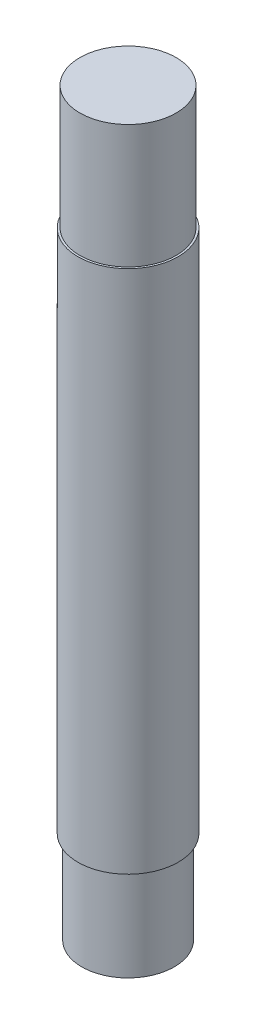
from build123d import *

# Parameters (mm, degrees)
SKETCH1_R           = 5.159375
BOSS_EXTRUDE1_DEPTH = 76.2
SKETCH2_R           = 5.582507509
SKETCH2_R_2         = 4.95
CUT_EXTRUDE1_DEPTH  = 12.7
CUT_EXTRUDE2_DEPTH  = 15.24
SKETCH5_R           = 6.855394903
SKETCH5_R_2         = 4.7625
CUT_EXTRUDE3_DEPTH  = 9.525


with BuildPart() as part:
    # Sketch1 → Boss-Extrude1 (new body)
    with BuildSketch(Plane(origin=(0, 0, 0), x_dir=(1, 0, 0), z_dir=(0, 1, 0))):
        with Locations(Location((0, 0, 0), (0, 0, 90))):
            Circle(SKETCH1_R)
    extrude(amount=BOSS_EXTRUDE1_DEPTH)

    # Sketch2 → Cut-Extrude1 (cut)
    with BuildSketch(Plane(origin=(0, 76.2, 0), x_dir=(1, 0, 0), z_dir=(0, 1, 0))):
        Circle(SKETCH2_R)
        with Locations(Location((0, 0, 0), (0, 0, 270))):
            Circle(SKETCH2_R_2, mode=Mode.SUBTRACT)
    extrude(amount=-CUT_EXTRUDE1_DEPTH, mode=Mode.SUBTRACT)

    # Sketch4 → Cut-Extrude2 (cut)
    with BuildSketch(Plane(origin=(4747.84892855, 34.473117596, 51.91521842), x_dir=(-1, 0, 0), z_dir=(0, -1, 0))):
        Polygon((4747.84892855, 56.48021842), (4739.672253117, 56.48021842), (4739.672253117, 59.680433841), (4755.943170737, 59.680433841), (4755.943170737, 56.48021842), align=None)
    extrude(amount=-CUT_EXTRUDE2_DEPTH, mode=Mode.SUBTRACT)

    # Sketch5 → Cut-Extrude3 (cut)
    with BuildSketch(Plane.XZ):
        Circle(SKETCH5_R)
        with Locations(Location((0, 0, 0), (0, 0, 270))):
            Circle(SKETCH5_R_2, mode=Mode.SUBTRACT)
    extrude(amount=-CUT_EXTRUDE3_DEPTH, mode=Mode.SUBTRACT)


solid = part.part
